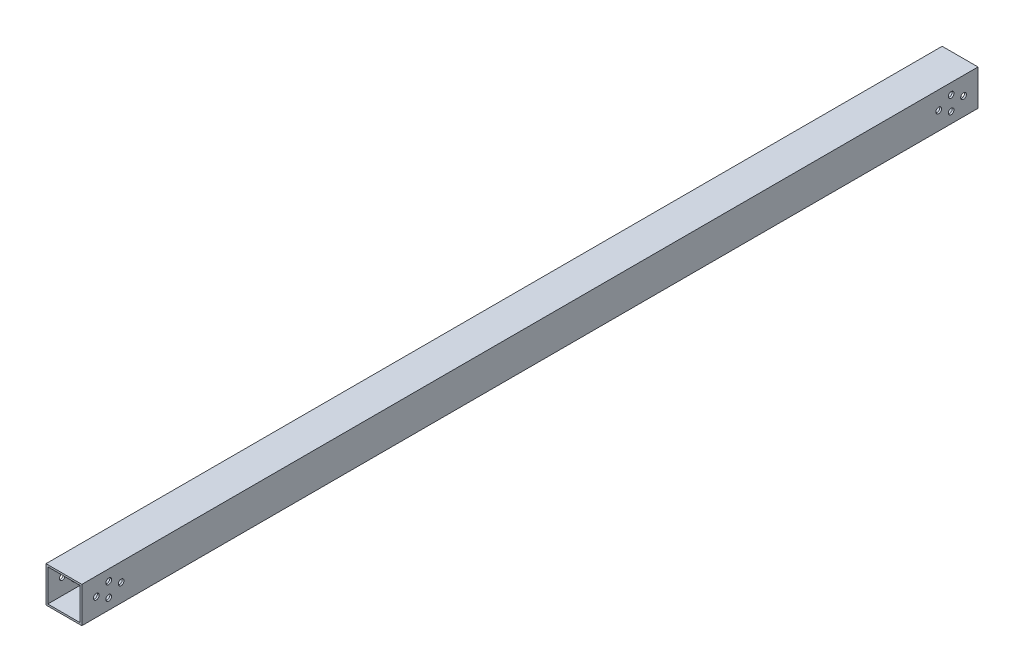
from build123d import *

# Parameters (mm, degrees)
SKETCH_1_W          = 20
SKETCH_1_H          = 20
SKETCH_1_W_2        = 18
SKETCH_1_H_2        = 18
EXTRUDE_1_DEPTH     = 500
CUT_EXTRUDE_1_REACH = 502.5
SKETCH_2_R          = 1.6


with BuildPart() as part:
    # 草图1 → 凸台-拉伸1 (new body)
    with BuildSketch(Plane.XY):
        Rectangle(SKETCH_1_W, SKETCH_1_H)
        Rectangle(SKETCH_1_W_2, SKETCH_1_H_2, mode=Mode.SUBTRACT)
    extrude(amount=EXTRUDE_1_DEPTH)

    # 切除-拉伸1: up to this face of the body (flat: up to its plane)
    cut_extrude_1_end = Plane(part.part.faces().sort_by_distance((10, 0, 250))[0])
    # 草图2 → 切除-拉伸1 (cut, up to the picked face)
    with BuildSketch(Plane.ZY.offset(10), mode=Mode.PRIVATE) as cut_extrude_1_sk1:
        with Locations((15, -4)):
            Circle(SKETCH_2_R)
    cut_extrude_1_tool1 = split(extrude(cut_extrude_1_sk1.sketch, amount=-CUT_EXTRUDE_1_REACH, mode=Mode.PRIVATE), bisect_by=cut_extrude_1_end, keep=Keep.BOTH, mode=Mode.PRIVATE)
    # 草图2 → 切除-拉伸1 (cut, up to the picked face)
    with BuildSketch(Plane.ZY.offset(10), mode=Mode.PRIVATE) as cut_extrude_1_sk2:
        with Locations((15, 4)):
            Circle(SKETCH_2_R)
    cut_extrude_1_tool2 = split(extrude(cut_extrude_1_sk2.sketch, amount=-CUT_EXTRUDE_1_REACH, mode=Mode.PRIVATE), bisect_by=cut_extrude_1_end, keep=Keep.BOTH, mode=Mode.PRIVATE)
    # 草图2 → 切除-拉伸1 (cut, up to the picked face)
    with BuildSketch(Plane.ZY.offset(10), mode=Mode.PRIVATE) as cut_extrude_1_sk3:
        with Locations((8.07179677, 0)):
            Circle(SKETCH_2_R)
    cut_extrude_1_tool3 = split(extrude(cut_extrude_1_sk3.sketch, amount=-CUT_EXTRUDE_1_REACH, mode=Mode.PRIVATE), bisect_by=cut_extrude_1_end, keep=Keep.BOTH, mode=Mode.PRIVATE)
    # 草图2 → 切除-拉伸1 (cut, up to the picked face)
    with BuildSketch(Plane.ZY.offset(10), mode=Mode.PRIVATE) as cut_extrude_1_sk4:
        with Locations((21.92820323, 0)):
            Circle(SKETCH_2_R)
    cut_extrude_1_tool4 = split(extrude(cut_extrude_1_sk4.sketch, amount=-CUT_EXTRUDE_1_REACH, mode=Mode.PRIVATE), bisect_by=cut_extrude_1_end, keep=Keep.BOTH, mode=Mode.PRIVATE)
    # 草图2 → 切除-拉伸1 (cut, up to the picked face)
    with BuildSketch(Plane.ZY.offset(10), mode=Mode.PRIVATE) as cut_extrude_1_sk5:
        with Locations((478.07179677, 0)):
            Circle(SKETCH_2_R)
    cut_extrude_1_tool5 = split(extrude(cut_extrude_1_sk5.sketch, amount=-CUT_EXTRUDE_1_REACH, mode=Mode.PRIVATE), bisect_by=cut_extrude_1_end, keep=Keep.BOTH, mode=Mode.PRIVATE)
    # 草图2 → 切除-拉伸1 (cut, up to the picked face)
    with BuildSketch(Plane.ZY.offset(10), mode=Mode.PRIVATE) as cut_extrude_1_sk6:
        with Locations((485, 4)):
            Circle(SKETCH_2_R)
    cut_extrude_1_tool6 = split(extrude(cut_extrude_1_sk6.sketch, amount=-CUT_EXTRUDE_1_REACH, mode=Mode.PRIVATE), bisect_by=cut_extrude_1_end, keep=Keep.BOTH, mode=Mode.PRIVATE)
    # 草图2 → 切除-拉伸1 (cut, up to the picked face)
    with BuildSketch(Plane.ZY.offset(10), mode=Mode.PRIVATE) as cut_extrude_1_sk7:
        with Locations((485, -4)):
            Circle(SKETCH_2_R)
    cut_extrude_1_tool7 = split(extrude(cut_extrude_1_sk7.sketch, amount=-CUT_EXTRUDE_1_REACH, mode=Mode.PRIVATE), bisect_by=cut_extrude_1_end, keep=Keep.BOTH, mode=Mode.PRIVATE)
    # 草图2 → 切除-拉伸1 (cut, up to the picked face)
    with BuildSketch(Plane.ZY.offset(10), mode=Mode.PRIVATE) as cut_extrude_1_sk8:
        with Locations((491.92820323, 0)):
            Circle(SKETCH_2_R)
    cut_extrude_1_tool8 = split(extrude(cut_extrude_1_sk8.sketch, amount=-CUT_EXTRUDE_1_REACH, mode=Mode.PRIVATE), bisect_by=cut_extrude_1_end, keep=Keep.BOTH, mode=Mode.PRIVATE)
    add(cut_extrude_1_tool1.solids().sort_by(Axis((-10, -4, 15), (1, 0, 0)))[0], mode=Mode.SUBTRACT)
    add(cut_extrude_1_tool2.solids().sort_by(Axis((-10, 4, 15), (1, 0, 0)))[0], mode=Mode.SUBTRACT)
    add(cut_extrude_1_tool3.solids().sort_by(Axis((-10, 0, 8.071797), (1, 0, 0)))[0], mode=Mode.SUBTRACT)
    add(cut_extrude_1_tool4.solids().sort_by(Axis((-10, 0, 21.928203), (1, 0, 0)))[0], mode=Mode.SUBTRACT)
    add(cut_extrude_1_tool5.solids().sort_by(Axis((-10, 0, 478.071797), (1, 0, 0)))[0], mode=Mode.SUBTRACT)
    add(cut_extrude_1_tool6.solids().sort_by(Axis((-10, 4, 485), (1, 0, 0)))[0], mode=Mode.SUBTRACT)
    add(cut_extrude_1_tool7.solids().sort_by(Axis((-10, -4, 485), (1, 0, 0)))[0], mode=Mode.SUBTRACT)
    add(cut_extrude_1_tool8.solids().sort_by(Axis((-10, 0, 491.928203), (1, 0, 0)))[0], mode=Mode.SUBTRACT)


solid = part.part
